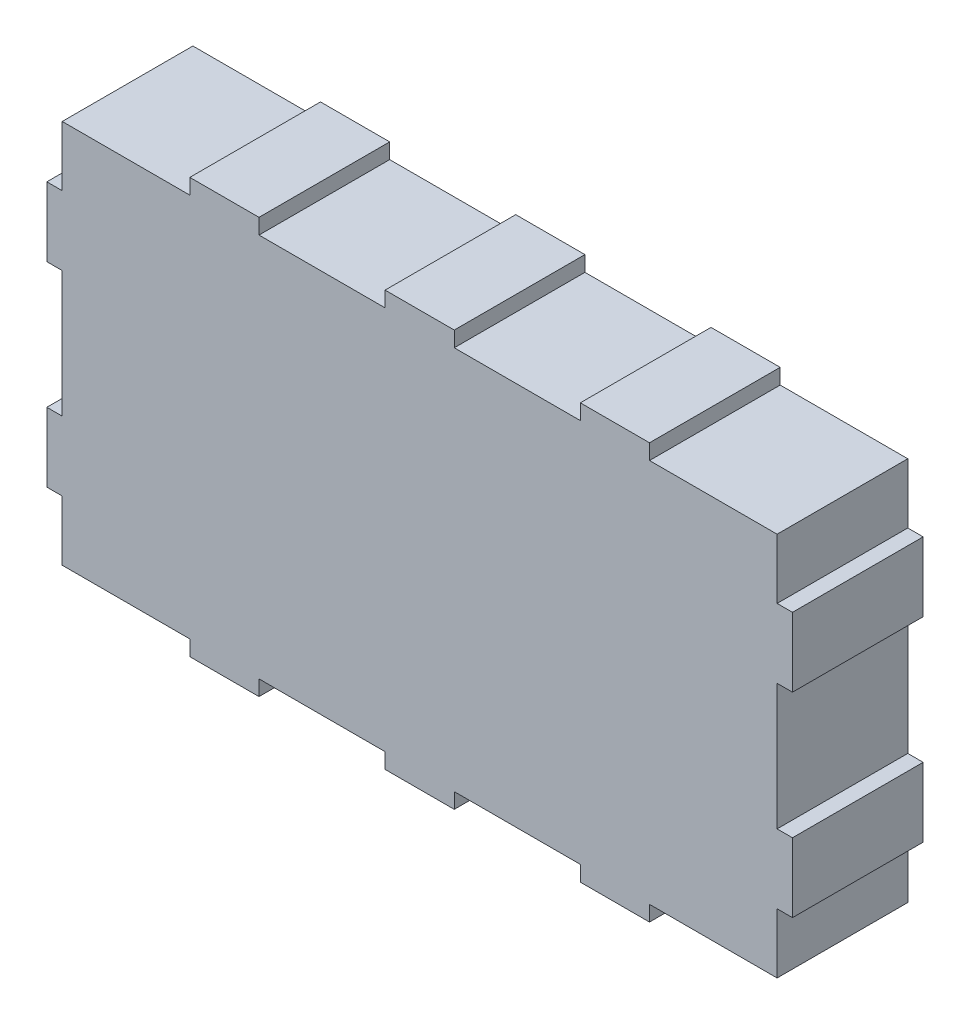
from build123d import *

# Parameters (mm, degrees)
COMPONENT_OUTLINE_DEPTH = 1.7


with BuildPart() as part:
    # 草图1 → Component_Outline (new body)
    with BuildSketch(Plane.XY):
        Polygon((-4.85, 1.72), (-4.65, 1.72), (-4.65, 2.5), (-2.99, 2.5), (-2.99, 2.7), (-2.09, 2.7), (-2.09, 2.5), (-0.45, 2.5), (-0.45, 2.7), (0.45, 2.7), (0.45, 2.5), (2.09, 2.5), (2.09, 2.7), (2.99, 2.7), (2.99, 2.5), (4.65, 2.5), (4.65, 1.72), (4.85, 1.72), (4.85, 0.82), (4.65, 0.82), (4.65, -0.82), (4.85, -0.82), (4.85, -1.72), (4.65, -1.72), (4.65, -2.5), (2.99, -2.5), (2.99, -2.7), (2.09, -2.7), (2.09, -2.5), (0.45, -2.5), (0.45, -2.7), (-0.45, -2.7), (-0.45, -2.5), (-2.09, -2.5), (-2.09, -2.7), (-2.99, -2.7), (-2.99, -2.5), (-3, -2.5), (-4.65, -2.5), (-4.65, -1.72), (-4.85, -1.72), (-4.85, -0.82), (-4.65, -0.82), (-4.65, 0.82), (-4.85, 0.82), align=None)
    extrude(amount=COMPONENT_OUTLINE_DEPTH)


solid = part.part
